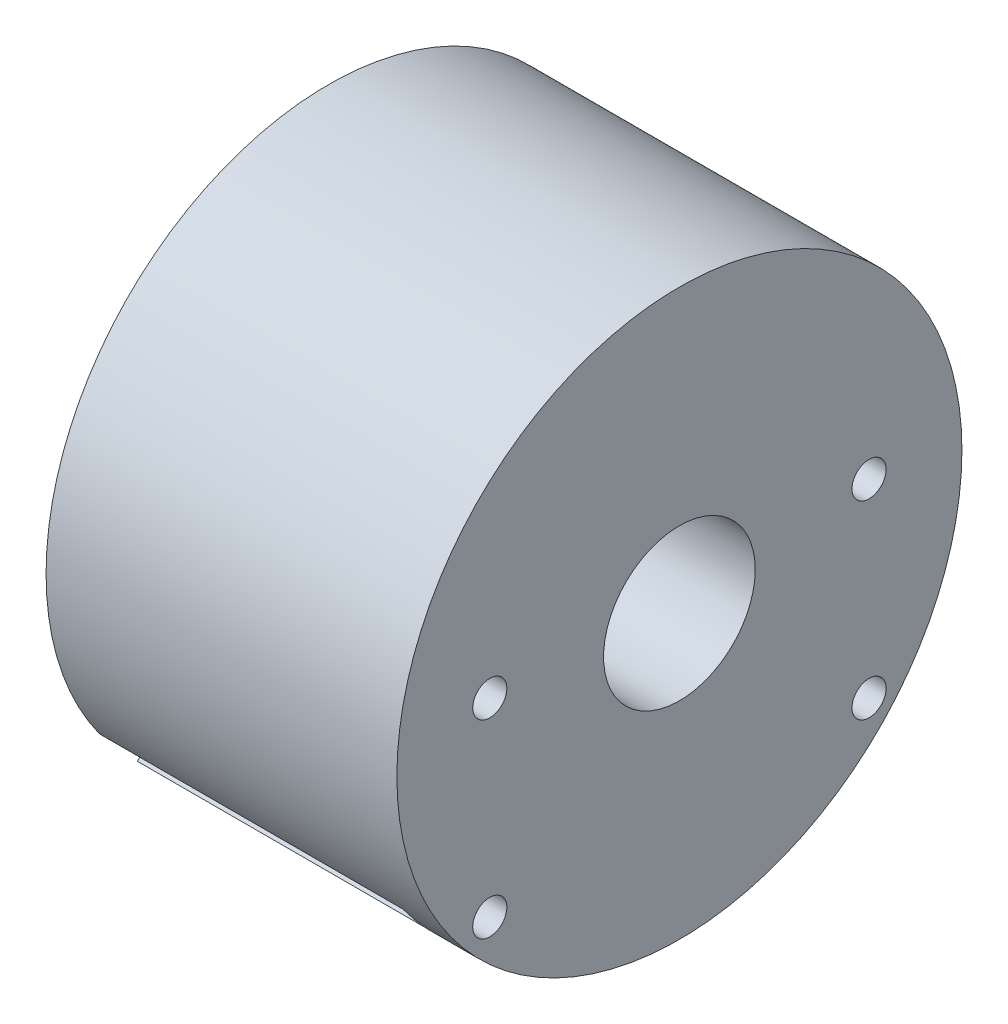
from build123d import *

# Parameters (mm, degrees)
SKETCH2_R            = 3
SKETCH2_R_2          = 8
BOSS_EXTRUDE1_DEPTH  = 37
M4_CLEARANCE_HOLE1_D = 3.6
CUT_EXTRUDE1_START   = -37
SKETCH2_3_R          = 3
CUT_EXTRUDE1_DEPTH   = 32


with BuildPart() as part:
    # Sketch2 → Boss-Extrude1 (new body)
    # profile 1 of 5: a face of its own
    with BuildSketch(Plane(origin=(0, 0, 0), x_dir=(0, 0, -1), z_dir=(1, 0, 0))):
        with BuildLine():
            Line((-24.16628289, -17.436478179), (-21.991350056, -15.506225289))
            ThreePointArc((-21.991350056, -15.506225289), (-17.756225289, -15.758649944), (-18.008649944, -19.993774711))
            Line((-18.008649944, -19.993774711), (-20.183582778, -21.924027601))
            ThreePointArc((-20.183582778, -21.924027601), (0, -29.8), (20.183582778, -21.924027601))
            Line((20.183582778, -21.924027601), (18.008649944, -19.993774711))
            ThreePointArc((18.008649944, -19.993774711), (17.756225289, -15.758649944), (21.991350056, -15.506225289))
            Line((21.991350056, -15.506225289), (24.16628289, -17.436478179))
            ThreePointArc((24.16628289, -17.436478179), (28.356615014, -9.162007692), (29.8, 0))
            ThreePointArc((29.8, 0), (-9.162007692, 28.356615014), (-24.16628289, -17.436478179))
        make_face()
        with Locations((-20, 2.25)):
            Circle(SKETCH2_R, mode=Mode.SUBTRACT)
        Circle(SKETCH2_R_2, mode=Mode.SUBTRACT)
        with Locations((20, 2.25)):
            Circle(SKETCH2_R, mode=Mode.SUBTRACT)
    # profile 2 of 5: a face of its own
    with BuildSketch(Plane(origin=(0, 0, 0), x_dir=(0, 0, -1), z_dir=(1, 0, 0))):
        with Locations((20, 2.25)):
            Circle(SKETCH2_R)
    # profile 3 of 5: a face of its own
    with BuildSketch(Plane(origin=(0, 0, 0), x_dir=(0, 0, -1), z_dir=(1, 0, 0))):
        with Locations((-20, 2.25)):
            Circle(SKETCH2_R)
    # profile 4 of 5: a face of its own
    with BuildSketch(Plane(origin=(0, 0, 0), x_dir=(0, 0, -1), z_dir=(1, 0, 0))):
        with BuildLine():
            ThreePointArc((20.183582778, -21.924027601), (22.28816213, -19.78074389), (24.16628289, -17.436478179))
            Line((24.16628289, -17.436478179), (21.991350056, -15.506225289))
            ThreePointArc((21.991350056, -15.506225289), (17.756225289, -15.758649944), (18.008649944, -19.993774711))
            Line((18.008649944, -19.993774711), (20.183582778, -21.924027601))
        make_face()
    # profile 5 of 5: a face of its own
    with BuildSketch(Plane(origin=(0, 0, 0), x_dir=(0, 0, -1), z_dir=(1, 0, 0))):
        with BuildLine():
            ThreePointArc((-18.008649944, -19.993774711), (-17.756225289, -15.758649944), (-21.991350056, -15.506225289))
            Line((-21.991350056, -15.506225289), (-24.16628289, -17.436478179))
            ThreePointArc((-24.16628289, -17.436478179), (-22.28816213, -19.78074389), (-20.183582778, -21.924027601))
            Line((-20.183582778, -21.924027601), (-18.008649944, -19.993774711))
        make_face()
    extrude(amount=-BOSS_EXTRUDE1_DEPTH)

    # M4 Clearance Hole1 (through all)
    with Locations(Plane.ZY.offset(37)):
        with Locations((-20, 2.25), (20, 2.25), (20, -17.75), (-20, -17.75)):
            Hole(M4_CLEARANCE_HOLE1_D / 2)

    # Sketch2<3> → Cut-Extrude1 (cut)
    with BuildSketch(Plane(origin=(0, 0, 0), x_dir=(0, 0, -1), z_dir=(1, 0, 0)).offset(CUT_EXTRUDE1_START)):
        with Locations((20, 2.25)):
            Circle(SKETCH2_3_R)
        with Locations((-20, 2.25)):
            Circle(SKETCH2_3_R)
        with BuildLine():
            ThreePointArc((-18.008649944, -19.993774711), (-17.756225289, -15.758649944), (-21.991350056, -15.506225289))
            Line((-21.991350056, -15.506225289), (-24.16628289, -17.436478179))
            ThreePointArc((-24.16628289, -17.436478179), (-22.28816213, -19.78074389), (-20.183582778, -21.924027601))
            Line((-20.183582778, -21.924027601), (-18.008649944, -19.993774711))
        make_face()
        with BuildLine():
            ThreePointArc((20.183582778, -21.924027601), (22.28816213, -19.78074389), (24.16628289, -17.436478179))
            Line((24.16628289, -17.436478179), (21.991350056, -15.506225289))
            ThreePointArc((21.991350056, -15.506225289), (17.756225289, -15.758649944), (18.008649944, -19.993774711))
            Line((18.008649944, -19.993774711), (20.183582778, -21.924027601))
        make_face()
    extrude(amount=CUT_EXTRUDE1_DEPTH, mode=Mode.SUBTRACT)


solid = part.part
